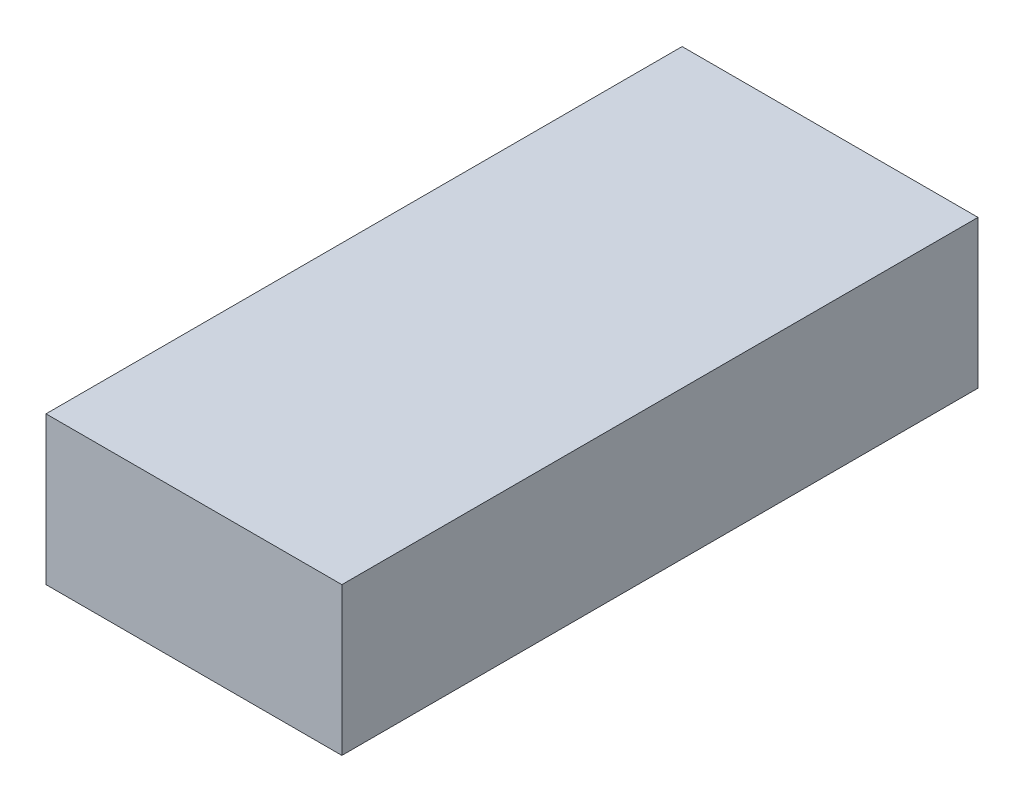
from build123d import *

# Parameters (mm, degrees)
SKETCH_1_W      = 20
SKETCH_1_H      = 43
EXTRUDE_1_DEPTH = 10


with BuildPart() as part:
    # 草图1 → 凸台-拉伸1 (new body)
    with BuildSketch(Plane(origin=(0, 0, 0), x_dir=(1, 0, 0), z_dir=(0, 1, 0))):
        Rectangle(SKETCH_1_W, SKETCH_1_H)
    extrude(amount=EXTRUDE_1_DEPTH)


solid = part.part
